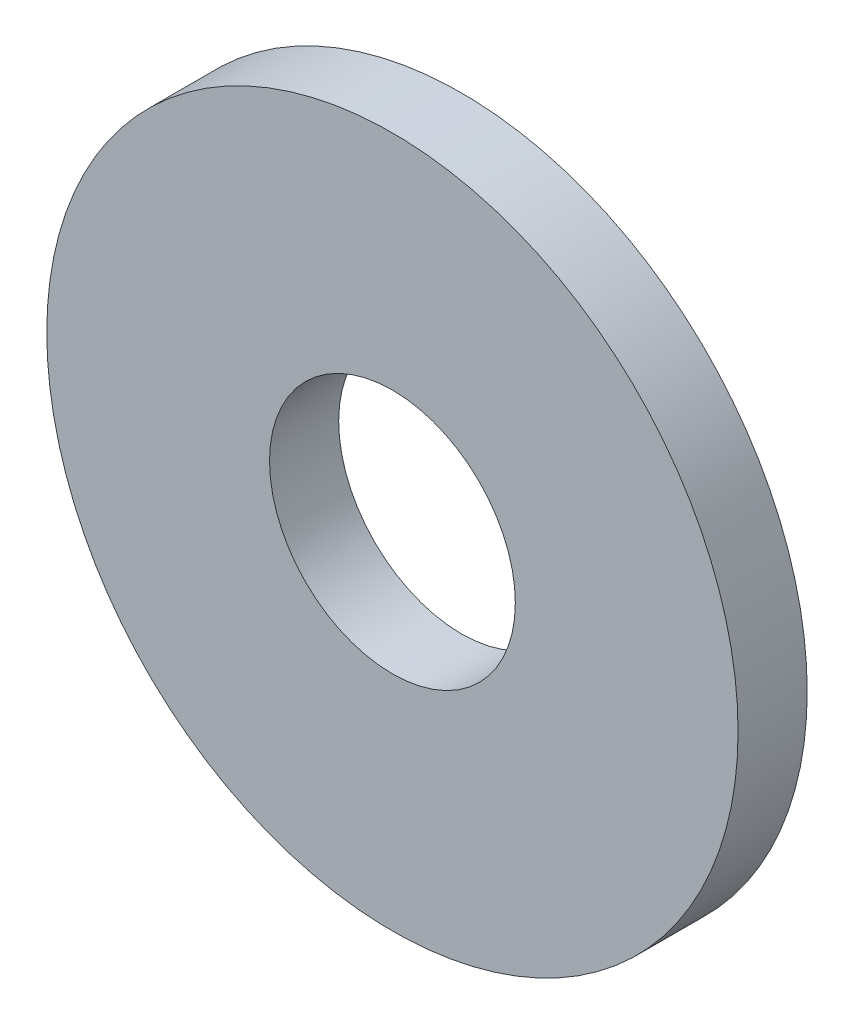
from build123d import *

# Parameters (mm, degrees)
SKETCH1_R           = 9
SKETCH1_R_2         = 3.2
BOSS_EXTRUDE1_DEPTH = 1.8


with BuildPart() as part:
    # Sketch1 → Boss-Extrude1 (new body)
    with BuildSketch(Plane.XY):
        Circle(SKETCH1_R)
        Circle(SKETCH1_R_2, mode=Mode.SUBTRACT)
    extrude(amount=BOSS_EXTRUDE1_DEPTH)


solid = part.part
